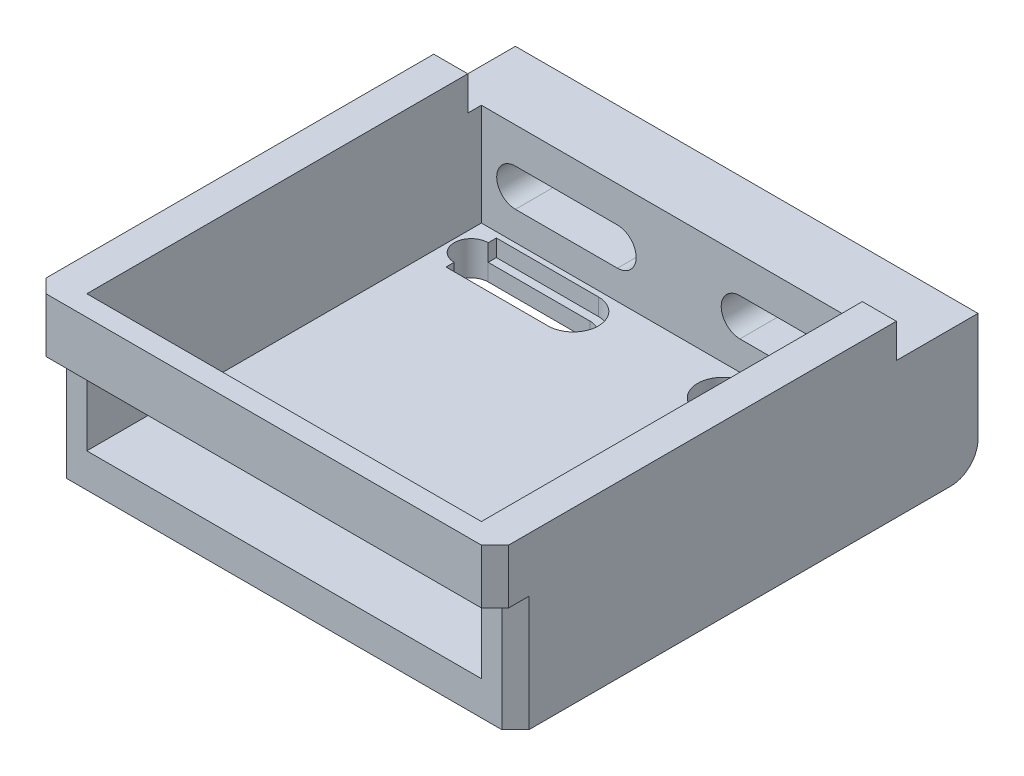
from build123d import *

# Parameters (mm, degrees)
EXTRUDE_2_DEPTH     = 68
SKETCH_2_W          = 5
SKETCH_2_H          = 58
EXTRUDE_3_DEPTH     = 20
CUT_EXTRUDE_1_DEPTH = 20
FILLET_1_R          = 4
SKETCH_4_W          = 68
SKETCH_4_H          = 3
EXTRUDE_4_DEPTH     = 8
CHAMFER_1_SIZE      = 2
CUT_EXTRUDE_3_DEPTH = 8
CUT_EXTRUDE_START   = -2.5
CUT_EXTRUDE_4_DEPTH = 2.5


with BuildPart() as part:
    # 草图1 → 凸台-拉伸2 (new body)
    with BuildSketch(Plane(origin=(0, 0, 0), x_dir=(0, 0, -1), z_dir=(1, 0, 0))):
        Polygon((0, 0), (-68, 0), (-68, 5), (-10, 5), (-10, 20), (0, 20), align=None)
    extrude(amount=EXTRUDE_2_DEPTH)

    # 草图2 → 凸台-拉伸3 (add)
    with BuildSketch(Plane(origin=(0, 5, 0), x_dir=(1, 0, 0), z_dir=(0, 1, 0))):
        with Locations((65.5, -39)):
            Rectangle(SKETCH_2_W, SKETCH_2_H)
        with Locations((2.5, -39)):
            Rectangle(SKETCH_2_W, SKETCH_2_H)
    extrude(amount=EXTRUDE_3_DEPTH)

    # 草图3 → 切除-拉伸1 (cut)
    with BuildSketch(Plane(origin=(0, 0, 0), x_dir=(-1, 0, 0), z_dir=(0, 0, -1))):
        with BuildLine():
            Line((-58, 14.75), (-43, 14.75))
            ThreePointArc((-43, 14.75), (-40.25, 12), (-43, 9.25))
            Line((-43, 9.25), (-58, 9.25))
            ThreePointArc((-58, 9.25), (-60.75, 12), (-58, 14.75))
        make_face()
        with BuildLine():
            Line((-25, 14.75), (-10, 14.75))
            ThreePointArc((-10, 14.75), (-7.25, 12), (-10, 9.25))
            Line((-10, 9.25), (-25, 9.25))
            ThreePointArc((-25, 9.25), (-27.75, 12), (-25, 14.75))
        make_face()
    extrude(amount=-CUT_EXTRUDE_1_DEPTH, mode=Mode.SUBTRACT)

    # 圆角1
    fillet_1_edges = [part.edges().sort_by_distance(p)[0] for p in [
        (34, 0, 0),
    ]]
    fillet(fillet_1_edges, radius=FILLET_1_R)

    # 草图4 → 凸台-拉伸4 (add)
    with BuildSketch(Plane(origin=(0, 25, 0), x_dir=(1, 0, 0), z_dir=(0, 1, 0))):
        with Locations((34, -69.5)):
            Rectangle(SKETCH_4_W, SKETCH_4_H)
    extrude(amount=-EXTRUDE_4_DEPTH)

    # 倒角1
    chamfer_1_edges = [part.edges().sort_by_distance(p)[0] for p in [
        (68, 21, 71),
        (0, 21, 71),
        (68, 22.5, 10),
        (63, 22.5, 10),
        (65.5, 25, 10),
        (5, 22.5, 10),
        (0, 22.5, 10),
        (2.5, 25, 10),
        (0, 8.5, 68),
        (68, 8.5, 68),
    ]]
    chamfer(chamfer_1_edges, length=CHAMFER_1_SIZE)

    # 草图5 → 切除-拉伸3 (cut)
    with BuildSketch(Plane.XZ):
        with BuildLine():
            Line((8, 17), (23, 17))
            ThreePointArc((23, 17), (25.5, 14.5), (23, 12))
            Line((23, 12), (8, 12))
            ThreePointArc((8, 12), (5.5, 14.5), (8, 17))
        make_face()
        with BuildLine():
            Line((45, 17), (60, 17))
            ThreePointArc((60, 17), (62.5, 14.5), (60, 12))
            Line((60, 12), (45, 12))
            ThreePointArc((45, 12), (42.5, 14.5), (45, 17))
        make_face()
    extrude(amount=-CUT_EXTRUDE_3_DEPTH, mode=Mode.SUBTRACT)

    # 草图7 → 切除-拉伸4 (cut)
    with BuildSketch(Plane(origin=(0, 5, 0), x_dir=(1, 0, 0), z_dir=(0, 1, 0)).offset(CUT_EXTRUDE_START)):
        with BuildLine():
            Line((23, -18.2), (8, -18.2))
            Line((8, -18.2), (8, -17))
            Line((8, -17), (23, -17))
            ThreePointArc((23, -17), (25.5, -14.5), (23, -12))
            Line((23, -12), (8, -12))
            Line((8, -12), (8, -10.8))
            Line((8, -10.8), (23, -10.8))
            ThreePointArc((23, -10.8), (26.7, -14.5), (23, -18.2))
        make_face()
        with BuildLine():
            Line((45, -10.8), (60, -10.8))
            Line((60, -10.8), (60, -12))
            Line((60, -12), (45, -12))
            ThreePointArc((45, -12), (42.5, -14.5), (45, -17))
            Line((45, -17), (60, -17))
            Line((60, -17), (60, -18.2))
            Line((60, -18.2), (45, -18.2))
            ThreePointArc((45, -18.2), (41.3, -14.5), (45, -10.8))
        make_face()
    extrude(amount=CUT_EXTRUDE_4_DEPTH, mode=Mode.SUBTRACT)


solid = part.part
